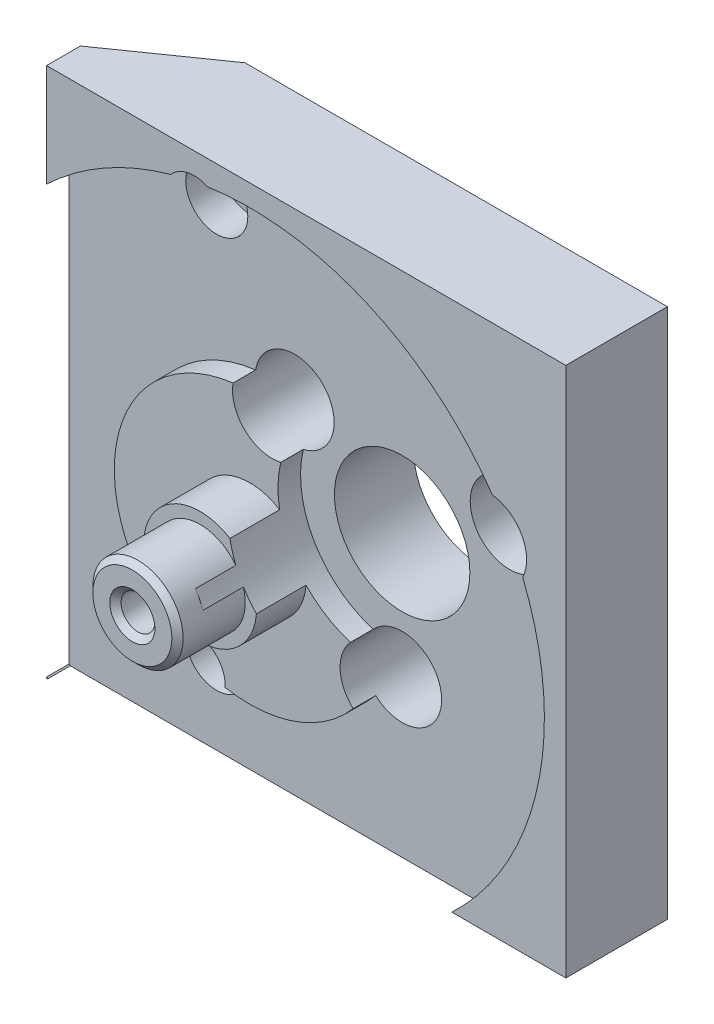
from build123d import *

# Parameters (mm, degrees)
SKETCH_1_W                  = 52
SKETCH_1_H                  = 47
EXTRUDE_336_DEPTH           = 9
SKETCH_2_R                  = 26.1
SKETCH_2_R_2                = 12
CUT_EXTRUDE_544_DEPTH       = 2
SKETCH_3_R                  = 5
EXTRUDE_1_DEPTH             = 4.4
SKETCH_4_R                  = 4
EXTRUDE_2_DEPTH             = 6
SKETCH_5_R                  = 1.5
CUT_EXTRUDE_852_DEPTH       = 10.1
CHAMFER_1_SIZE              = 0.5
CUT_EXTRUDE_1174_DEPTH      = 72.181177287
CUT_EXTRUDE_1174_DEPTH_BACK = 72.181177287
SKETCH_6_R                  = 6
CUT_EXTRUDE_1461_DEPTH      = 72.181177287
CUT_EXTRUDE_1461_DEPTH_BACK = 72.181177287
SKETCH_7_R                  = 1.6
CUT_EXTRUDE_START           = -5.5
SKETCH_8_R                  = 3.5
CUT_EXTRUDE_1708_DEPTH      = 77.681177287
PATTERN_CIRCULAR_1_COUNT    = 3
SKETCH_9_R                  = 1
CUT_EXTRUDE_2077_DEPTH      = 72.181177287
CUT_EXTRUDE_2390_DEPTH      = 72.181177287
CUT_EXTRUDE_2390_DEPTH_BACK = 3
SKETCH_10_R                 = 2.75
SKETCH_11_R                 = 1
CUT_EXTRUDE_9_DEPTH         = 7.5
CUT_EXTRUDE_1_DEPTH         = 73.72798636
CUT_EXTRUDE_2_DEPTH         = 73.72798636
SKETCH_14_R                 = 9
CUT_EXTRUDE_10_DEPTH        = 10


with BuildPart() as part:
    # 草图1 → Extrude 336 (new body)
    with BuildSketch(Plane.XY):
        with Locations((26, 23.5)):
            Rectangle(SKETCH_1_W, SKETCH_1_H)
    extrude(amount=EXTRUDE_336_DEPTH)

    # 草图2 → Cut-Extrude 544 (cut)
    with BuildSketch(Plane.XY.offset(9)):
        with Locations((24, 19)):
            Circle(SKETCH_2_R)
        with Locations((24, 19)):
            Circle(SKETCH_2_R_2, mode=Mode.SUBTRACT)
    extrude(amount=-CUT_EXTRUDE_544_DEPTH, mode=Mode.SUBTRACT)

    # 草图3 → 轮子连接1 (add)
    with BuildSketch(Plane.XY.offset(9)):
        with Locations((24, 19)):
            Circle(SKETCH_3_R)
    extrude(amount=EXTRUDE_1_DEPTH)

    # 草图4 → 轮子连接2 (add)
    with BuildSketch(Plane.XY.offset(13.4)):
        with Locations((24, 19)):
            Circle(SKETCH_4_R)
    extrude(amount=EXTRUDE_2_DEPTH)

    # 草图5 → Cut-Extrude 852 (cut)
    with BuildSketch(Plane.XY.offset(19.4)):
        with Locations((24, 19)):
            Circle(SKETCH_5_R)
    extrude(amount=-CUT_EXTRUDE_852_DEPTH, mode=Mode.SUBTRACT)

    # 倒角1
    chamfer_1_edges = [part.edges().sort_by_distance(p)[0] for p in [
        (20, 19, 19.4),
        (22.5, 19, 19.4),
    ]]
    chamfer(chamfer_1_edges, length=CHAMFER_1_SIZE)

    # 草图6 → Cut-Extrude 1174 (cut, two sides: drawn at the far end of the back side and taken through both)
    with BuildSketch(Plane.XY.offset(7).offset(-CUT_EXTRUDE_1174_DEPTH_BACK)):
        with Locations((35.5, 24.844655678)):
            Circle(SKETCH_6_R)
    extrude(amount=CUT_EXTRUDE_1174_DEPTH + CUT_EXTRUDE_1174_DEPTH_BACK, mode=Mode.SUBTRACT)

    # 草图7 → Cut-Extrude 1461 (cut, two sides: drawn at the far end of the back side and taken through both)
    with BuildSketch(Plane.XY.offset(7).offset(-CUT_EXTRUDE_1461_DEPTH_BACK)):
        with Locations((25.973720558, 30.344655678)):
            Circle(SKETCH_7_R)
        with Locations((45.026279442, 30.344655678)):
            Circle(SKETCH_7_R)
        with Locations((35.5, 13.844655678)):
            Circle(SKETCH_7_R)
    extrude(amount=CUT_EXTRUDE_1461_DEPTH + CUT_EXTRUDE_1461_DEPTH_BACK, mode=Mode.SUBTRACT)

    # 草图8 → Cut-Extrude 1708 (cut)
    with BuildSketch(Plane.XY.offset(7).offset(CUT_EXTRUDE_START)):
        with Locations(Location((45.026279442, 30.344655678, 0), (0, 0, 82.411277971))):
            Circle(SKETCH_8_R)
    cut_extrude_1708 = extrude(amount=CUT_EXTRUDE_1708_DEPTH, mode=Mode.SUBTRACT)

    # 阵列(圆周)1: Cut-Extrude 1708 ×3 about axis
    pattern_circular_1_axis = Axis((35.5, 24.844655678, 0), (0, 0, 1))
    for i in range(1, PATTERN_CIRCULAR_1_COUNT):
        add(cut_extrude_1708.rotate(pattern_circular_1_axis, i * 360 / PATTERN_CIRCULAR_1_COUNT), mode=Mode.SUBTRACT)

    # 草图9 → Cut-Extrude 2077 (cut, through all)
    with BuildSketch(Plane.XY.offset(7)):
        with Locations((19.075932294, 42.344655678)):
            Circle(SKETCH_9_R)
        with Locations((19.075932294, 7.344655678)):
            Circle(SKETCH_9_R)
    extrude(amount=-CUT_EXTRUDE_2077_DEPTH, mode=Mode.SUBTRACT)

    # 草图10 → Cut-Extrude 2390 (cut, two sides: drawn at the far end of the back side and taken through both)
    with BuildSketch(Plane.XY.offset(7).offset(-CUT_EXTRUDE_2390_DEPTH_BACK)):
        with Locations(Location((19.075932294, 42.344655678, 0), (0, 0, 139.177975249))):
            Circle(SKETCH_10_R)
        with Locations(Location((19.075932294, 7.344655678, 0), (0, 0, 137.224544141))):
            Circle(SKETCH_10_R)
    extrude(amount=CUT_EXTRUDE_2390_DEPTH + CUT_EXTRUDE_2390_DEPTH_BACK, mode=Mode.SUBTRACT)

    # 草图11 → 切除-拉伸9 (cut)
    with BuildSketch(Plane.XZ):
        with Locations(Location((15, 3.5, 0), (0, 0, 270))):
            Circle(SKETCH_11_R)
        with Locations(Location((50, 3.5, 0), (0, 0, 270))):
            Circle(SKETCH_11_R)
        with Locations(Location((32, 3.5, 0), (0, 0, 270))):
            Circle(SKETCH_11_R)
    extrude(amount=-CUT_EXTRUDE_9_DEPTH, mode=Mode.SUBTRACT)

    # 草图12 → 修改外形1 (cut, through all)
    with BuildSketch(Plane.XZ):
        Polygon((0, 8), (11.425184054, 0), (0, 0), align=None)
    extrude(amount=-CUT_EXTRUDE_1_DEPTH, mode=Mode.SUBTRACT)

    # 草图13 → 修改外形2 (cut, through all)
    with BuildSketch(Plane(origin=(0, 47, 0), x_dir=(1, 0, 0), z_dir=(0, 1, 0))):
        Polygon((0, -9), (6, -9), (6, -6), (14.56888804, 0), (11.425184054, 0), (0, -8), align=None)
    extrude(amount=-CUT_EXTRUDE_2_DEPTH, mode=Mode.SUBTRACT)

    # 草图14 → 切除-拉伸10 (cut)
    with BuildSketch(Plane.XY.offset(7)):
        with Locations((35.5, 24.844655678)):
            Circle(SKETCH_14_R)
    extrude(amount=CUT_EXTRUDE_10_DEPTH, mode=Mode.SUBTRACT)


solid = part.part
